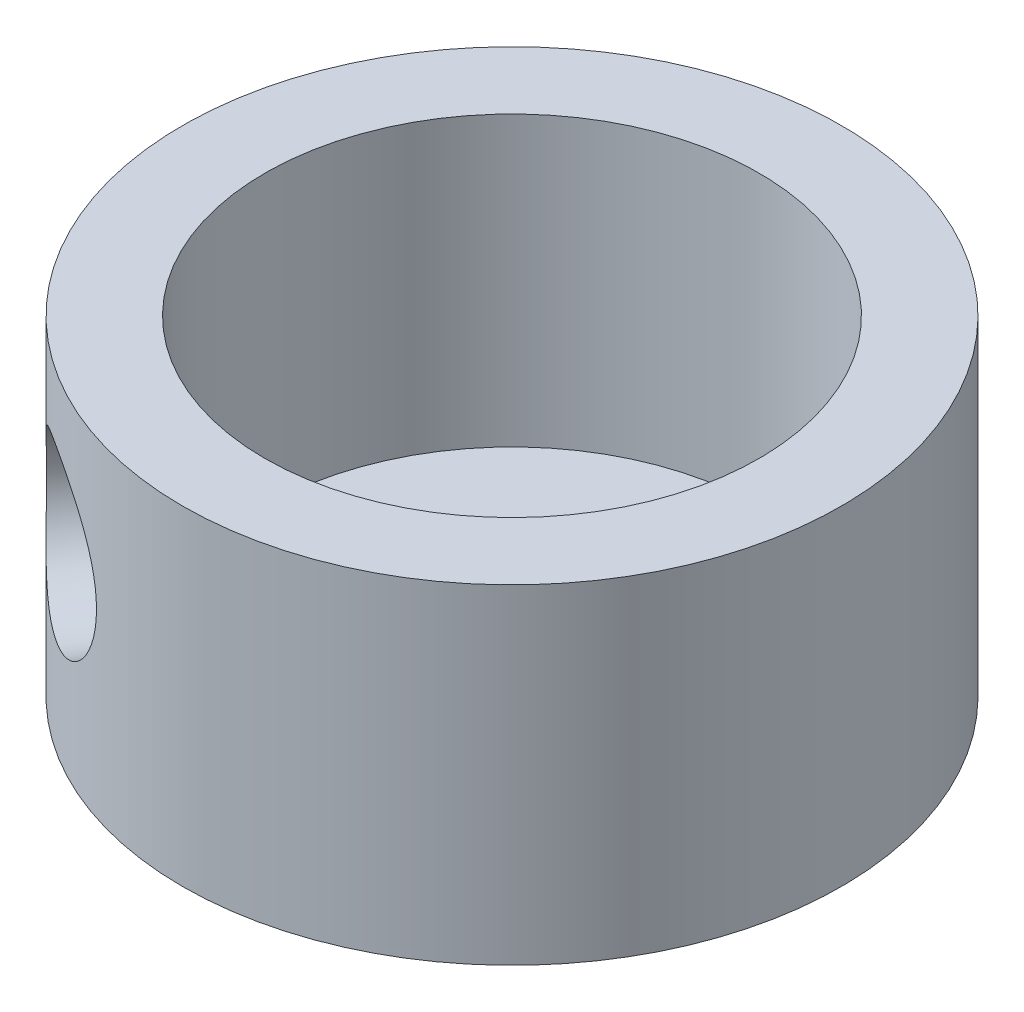
from build123d import *

# Parameters (mm, degrees)
SKETCH_1_R                     = 40
EXTRUDE_1_DEPTH                = 40
SKETCH_3_R                     = 30
CUT_EXTRUDE_2_DEPTH            = 35
HOLE_WIZARD_20_5_20_5_1_REACH  = 100.524
HOLE_WIZARD_20_5_20_5_1_BORE_R = 10.25


with BuildPart() as part:
    # 草圖1 → 填料-伸長1 (new body)
    with BuildSketch(Plane(origin=(0, 0, 0), x_dir=(1, 0, 0), z_dir=(0, 1, 0))):
        with Locations(Location((0, 0, 0), (0, 0, 270))):
            Circle(SKETCH_1_R)
    extrude(amount=EXTRUDE_1_DEPTH)

    # 草圖3 → 除料-伸長2 (cut)
    with BuildSketch(Plane(origin=(0, 40, 0), x_dir=(1, 0, 0), z_dir=(0, 1, 0))):
        with Locations(Location((0, 0, 0), (0, 0, 270))):
            Circle(SKETCH_3_R)
    extrude(amount=-CUT_EXTRUDE_2_DEPTH, mode=Mode.SUBTRACT)

    # Ø20.5 (20.5) 直徑孔1 bore (on position points) → Ø20.5 (20.5) 直徑孔1 (cut, up to next)
    with BuildSketch(Plane(origin=(-21.744758151, 21.94181737, 33.573285406), x_dir=(0.839332135156, 0, 0.543618953768), z_dir=(-0.543618953768, 0, 0.839332135156)), mode=Mode.PRIVATE) as hole_wizard_20_5_20_5_1_sk1:
        Circle(HOLE_WIZARD_20_5_20_5_1_BORE_R)
    hole_wizard_20_5_20_5_1_tool1 = extrude(hole_wizard_20_5_20_5_1_sk1.sketch, amount=-HOLE_WIZARD_20_5_20_5_1_REACH, mode=Mode.PRIVATE) & part.part
    add(hole_wizard_20_5_20_5_1_tool1.solids().sort_by_distance((-21.744758, 21.941817, 33.573285))[0], mode=Mode.SUBTRACT)


solid = part.part
